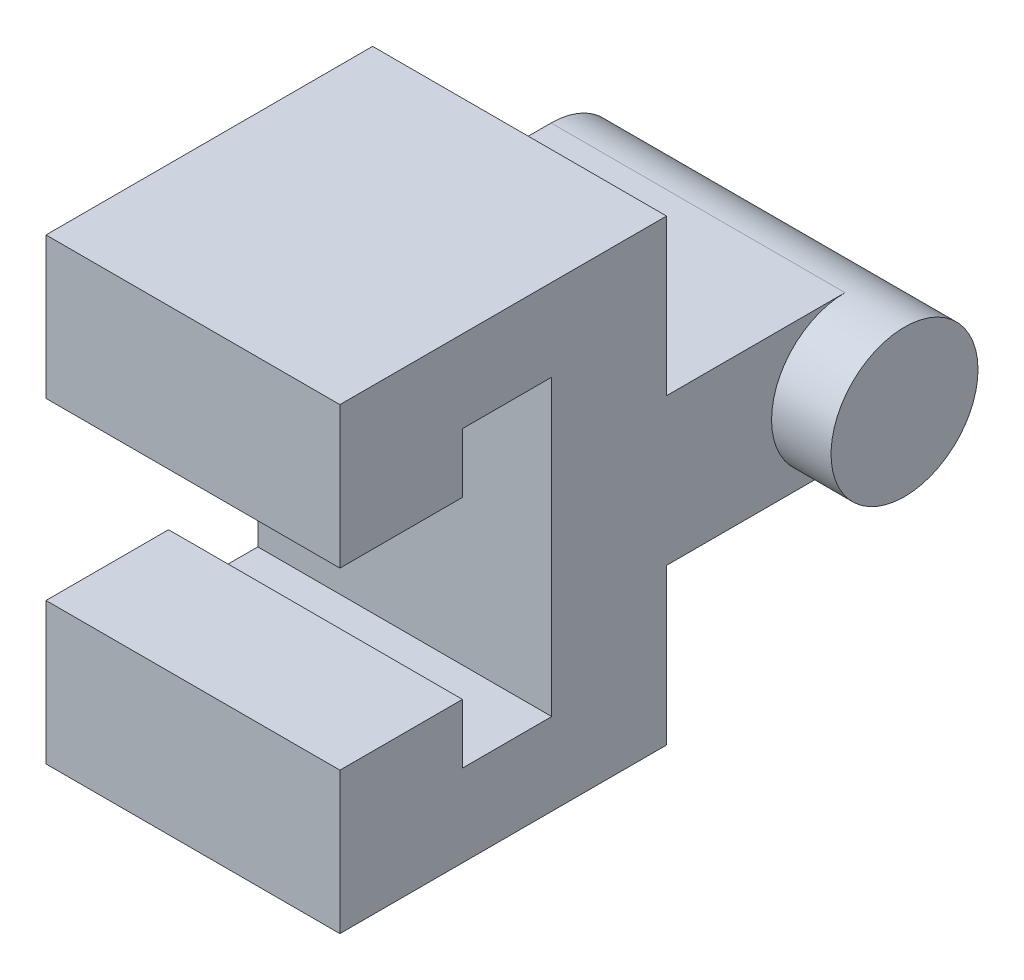
from build123d import *
from build123d.topology import SkipClean

# Parameters (mm, degrees)
SKETCH2_R           = 31.369
BOSS_EXTRUDE1_DEPTH = 25.4
BOSS_EXTRUDE2_START = 125.476
BOSS_EXTRUDE2_DEPTH = 125.476
BOSS_EXTRUDE3_DEPTH = 49.022
SKETCH8_W           = 125.476
SKETCH8_H           = 49.022
BOSS_EXTRUDE4_DEPTH = 35.052
SKETCH9_W           = 125.476
SKETCH9_H           = 49.022
BOSS_EXTRUDE5_DEPTH = 35.052
SKETCH10_W          = 125.476
SKETCH10_H          = 35.052
BOSS_EXTRUDE6_DEPTH = 38.1
SKETCH12_W          = 125.476
SKETCH12_H          = 60.452
BOSS_EXTRUDE7_DEPTH = 52.324


with BuildPart() as part:
    # Sketch2 → Boss-Extrude1 (new body)
    with BuildSketch(Plane.YZ):
        with Locations(Location((0, 0, 0), (0, 0, 270))):
            Circle(SKETCH2_R)
    extrude(amount=BOSS_EXTRUDE1_DEPTH)

    # Sketch4 → Boss-Extrude2 (add)
    with SkipClean():  # the faces are left unmerged after this step: merging them gives an invalid solid
        with BuildSketch(Plane(origin=(0, 0, 0), x_dir=(0, -1, 0), z_dir=(-1, 0, 0)).offset(BOSS_EXTRUDE2_START)):
            with BuildLine():
                Line((31.369, 0), (31.369, 76.2))
                Line((31.369, 76.2), (-31.369, 76.2))
                Line((-31.369, 76.2), (-31.369, 0))
                ThreePointArc((-31.369, 0), (0, -31.369), (31.369, 0))
            make_face()
        extrude(amount=-BOSS_EXTRUDE2_DEPTH)

    # Sketch5 → Boss-Extrude3 (add)
    with SkipClean():  # the faces are left unmerged after this step: merging them gives an invalid solid
        with BuildSketch(Plane.XY.offset(76.2)):
            Polygon((0, 0), (0, 62.747251031), (-125.476, 62.747251031), (-125.476, -62.747251031), (0, -62.747251031), align=None)
        extrude(amount=BOSS_EXTRUDE3_DEPTH)

    # Sketch8 → Boss-Extrude4 (add)
    with SkipClean():  # the faces are left unmerged after this step: merging them gives an invalid solid
        with BuildSketch(Plane(origin=(0, 62.747251031, 0), x_dir=(-1, 0, 0), z_dir=(0, 1, 0))):
            with Locations((62.738, 100.711)):
                Rectangle(SKETCH8_W, SKETCH8_H)
        extrude(amount=BOSS_EXTRUDE4_DEPTH)

    # Sketch9 → Boss-Extrude5 (add)
    with SkipClean():  # the faces are left unmerged after this step: merging them gives an invalid solid
        with BuildSketch(Plane.XZ.offset(62.747251031)):
            with Locations((-62.738, 100.711)):
                Rectangle(SKETCH9_W, SKETCH9_H)
        extrude(amount=BOSS_EXTRUDE5_DEPTH)

    # Sketch10 → Boss-Extrude6 (add)
    with SkipClean():  # the faces are left unmerged after this step: merging them gives an invalid solid
        with BuildSketch(Plane.XY.offset(125.222)):
            with Locations((-62.738, 80.273251031)):
                Rectangle(SKETCH10_W, SKETCH10_H)
            with Locations((-62.738, -80.273251031)):
                Rectangle(SKETCH10_W, SKETCH10_H)
        extrude(amount=BOSS_EXTRUDE6_DEPTH)

    # Sketch12 → Boss-Extrude7 (add)
    with SkipClean():  # the faces are left unmerged after this step: merging them gives an invalid solid
        with BuildSketch(Plane.XY.offset(163.322)):
            with Locations((-62.738, 67.573251031)):
                Rectangle(SKETCH12_W, SKETCH12_H)
            with Locations((-62.738, -67.573251031)):
                Rectangle(SKETCH12_W, SKETCH12_H)
        extrude(amount=BOSS_EXTRUDE7_DEPTH)


solid = part.part
